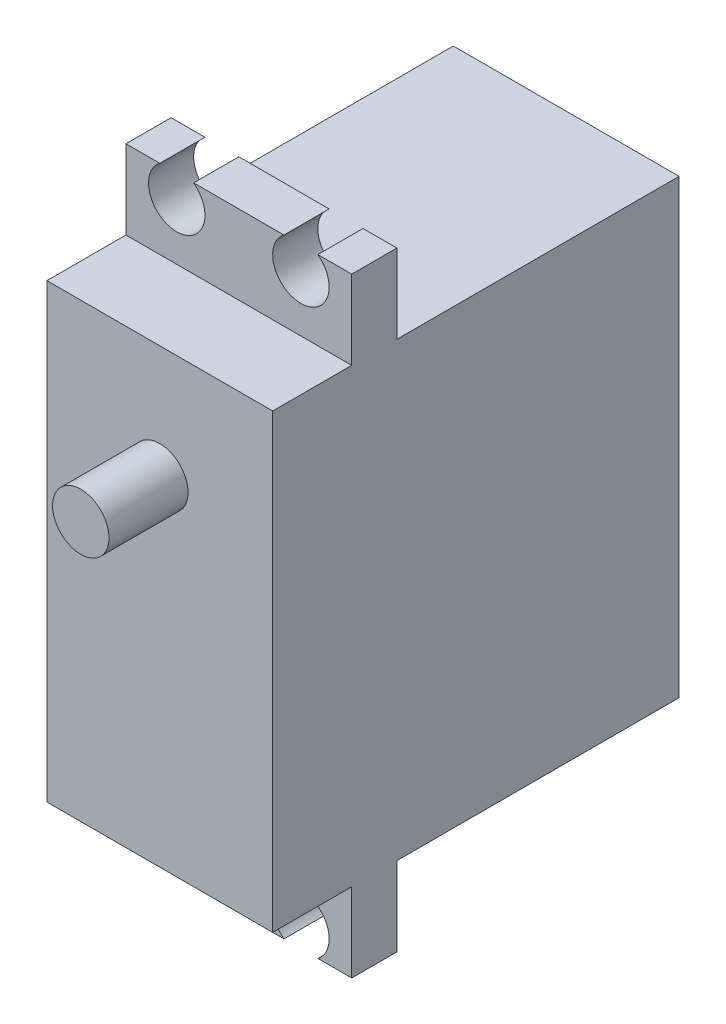
from build123d import *

# Parameters (mm, degrees)
ESQUISSE1_W             = 20
ESQUISSE1_H             = 40
BOSS_EXTRU_1_DEPTH      = 36
ESQUISSE2_W             = 20
ESQUISSE2_H             = 7
BOSS_EXTRU_2_DEPTH      = 11
ESQUISSE3_W             = 20
ESQUISSE3_H             = 7
ENL_V_MAT_EXTRU_1_DEPTH = 7
ESQUISSE4_R             = 2.5
BOSS_EXTRU_3_DEPTH      = 7
ESQUISSE5_R             = 2.5
ENL_V_MAT_EXTRU_2_DEPTH = 7
ESQUISSE6_R             = 2.5
ENL_V_MAT_EXTRU_3_DEPTH = 7


with BuildPart() as part:
    # Esquisse1 → Boss.-Extru.1 (new body)
    with BuildSketch(Plane.XY):
        with Locations((10, -20)):
            Rectangle(ESQUISSE1_W, ESQUISSE1_H)
    extrude(amount=BOSS_EXTRU_1_DEPTH)

    # Esquisse2 → Boss.-Extru.2 (add)
    with BuildSketch(Plane.XY.offset(36)):
        with Locations((10, 3.5)):
            Rectangle(ESQUISSE2_W, ESQUISSE2_H)
        with Locations((10, -43.5)):
            Rectangle(ESQUISSE2_W, ESQUISSE2_H)
    extrude(amount=-BOSS_EXTRU_2_DEPTH)

    # Esquisse3 → Enlèv. mat.-Extru.1 (cut)
    with BuildSketch(Plane.XY.offset(36)):
        with Locations((10, -43.5)):
            Rectangle(ESQUISSE3_W, ESQUISSE3_H)
        with Locations((10, 3.5)):
            Rectangle(ESQUISSE3_W, ESQUISSE3_H)
    extrude(amount=-ENL_V_MAT_EXTRU_1_DEPTH, mode=Mode.SUBTRACT)

    # Esquisse4 → Boss.-Extru.3 (add)
    with BuildSketch(Plane.XY.offset(36)):
        with Locations((10, -10)):
            Circle(ESQUISSE4_R)
    extrude(amount=BOSS_EXTRU_3_DEPTH)

    # Esquisse5 → Enlèv. mat.-Extru.2 (cut)
    with BuildSketch(Plane.XY.offset(29)):
        with Locations((4.5, -45)):
            Circle(ESQUISSE5_R)
        with Locations((15.5, -45)):
            Circle(ESQUISSE5_R)
    extrude(amount=-ENL_V_MAT_EXTRU_2_DEPTH, mode=Mode.SUBTRACT)

    # Esquisse6 → Enlèv. mat.-Extru.3 (cut)
    with BuildSketch(Plane.XY.offset(29)):
        with Locations((4.5, 5)):
            Circle(ESQUISSE6_R)
        with Locations((15.5, 5)):
            Circle(ESQUISSE6_R)
    extrude(amount=-ENL_V_MAT_EXTRU_3_DEPTH, mode=Mode.SUBTRACT)


solid = part.part
